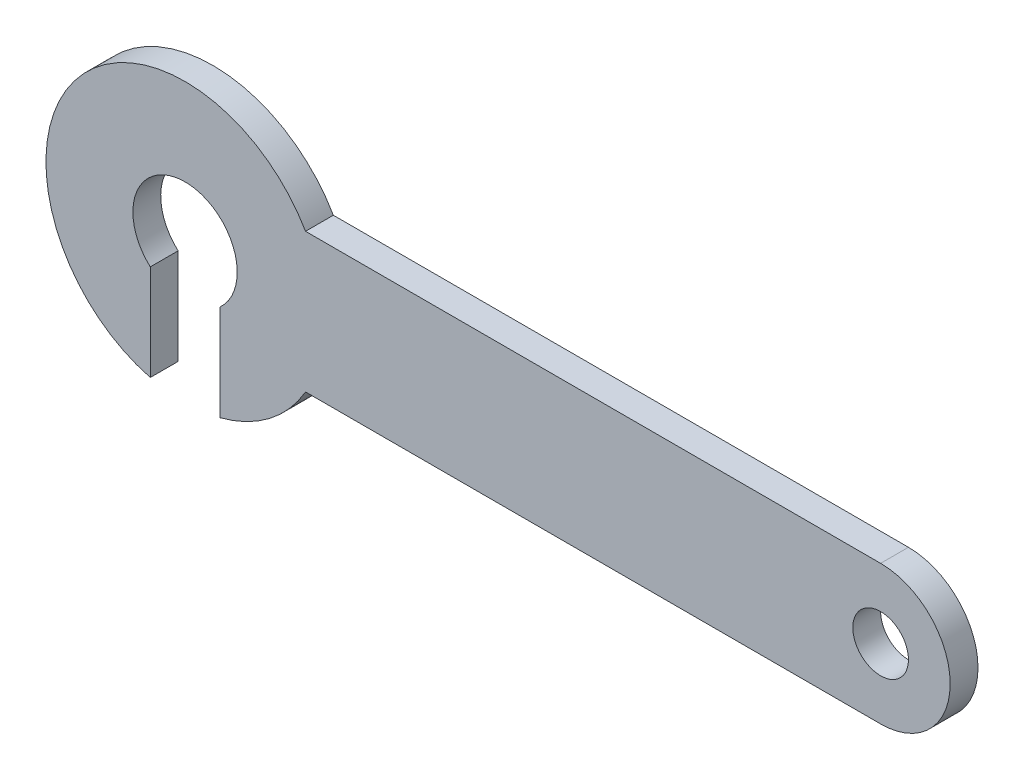
from build123d import *

# Parameters (mm, degrees)
BOSS_EXTRUDE1_DEPTH = 4
SKETCH2_R           = 4
CUT_EXTRUDE1_DEPTH  = 4
SKETCH3_R           = 7.5
CUT_EXTRUDE2_DEPTH  = 4
SKETCH4_W           = 10
SKETCH4_H           = 21.533858591
CUT_EXTRUDE3_DEPTH  = 4


with BuildPart() as part:
    # Sketch1 → Boss-Extrude1 (new body)
    with BuildSketch(Plane.XY):
        with BuildLine():
            ThreePointArc((110, 0), (107.071067812, 7.071067812), (100, 10))
            Line((100, 10), (100, 0))
            Line((100, 0), (100, -10))
            ThreePointArc((100, -10), (107.071067812, -7.071067812), (110, 0))
        make_face()
        with BuildLine():
            Line((100, 0), (100, 10))
            ThreePointArc((100, 10), (90, 0), (100, -10))
            Line((100, -10), (100, 0))
        make_face()
        with BuildLine():
            Line((100, 10), (17.320508076, 10))
            ThreePointArc((17.320508076, 10), (19.318516526, 5.176380902), (20, 0))
            ThreePointArc((20, 0), (19.318516526, -5.176380902), (17.320508076, -10))
            Line((17.320508076, -10), (100, -10))
            ThreePointArc((100, -10), (90, 0), (100, 10))
        make_face()
        with BuildLine():
            Line((0, -10), (0, 0))
            Line((0, 0), (0, 10))
            Line((0, 10), (17.320508076, 10))
            ThreePointArc((17.320508076, 10), (-20, 0), (17.320508076, -10))
            Line((17.320508076, -10), (0, -10))
        make_face()
        with BuildLine():
            Line((0, 10), (0, 0))
            Line((0, 0), (0, -10))
            Line((0, -10), (17.320508076, -10))
            ThreePointArc((17.320508076, -10), (19.318516526, -5.176380902), (20, 0))
            ThreePointArc((20, 0), (19.318516526, 5.176380902), (17.320508076, 10))
            Line((17.320508076, 10), (0, 10))
        make_face()
    extrude(amount=BOSS_EXTRUDE1_DEPTH)

    # Sketch2 → Cut-Extrude1 (cut)
    with BuildSketch(Plane.XY):
        with Locations((100, 0)):
            Circle(SKETCH2_R)
    extrude(amount=CUT_EXTRUDE1_DEPTH, mode=Mode.SUBTRACT)

    # Sketch3 → Cut-Extrude2 (cut)
    with BuildSketch(Plane.XY):
        Circle(SKETCH3_R)
    extrude(amount=CUT_EXTRUDE2_DEPTH, mode=Mode.SUBTRACT)

    # Sketch4 → Cut-Extrude3 (cut)
    with BuildSketch(Plane.XY):
        with Locations((0, -14.149166362)):
            Rectangle(SKETCH4_W, SKETCH4_H)
    extrude(amount=CUT_EXTRUDE3_DEPTH, mode=Mode.SUBTRACT)


solid = part.part
